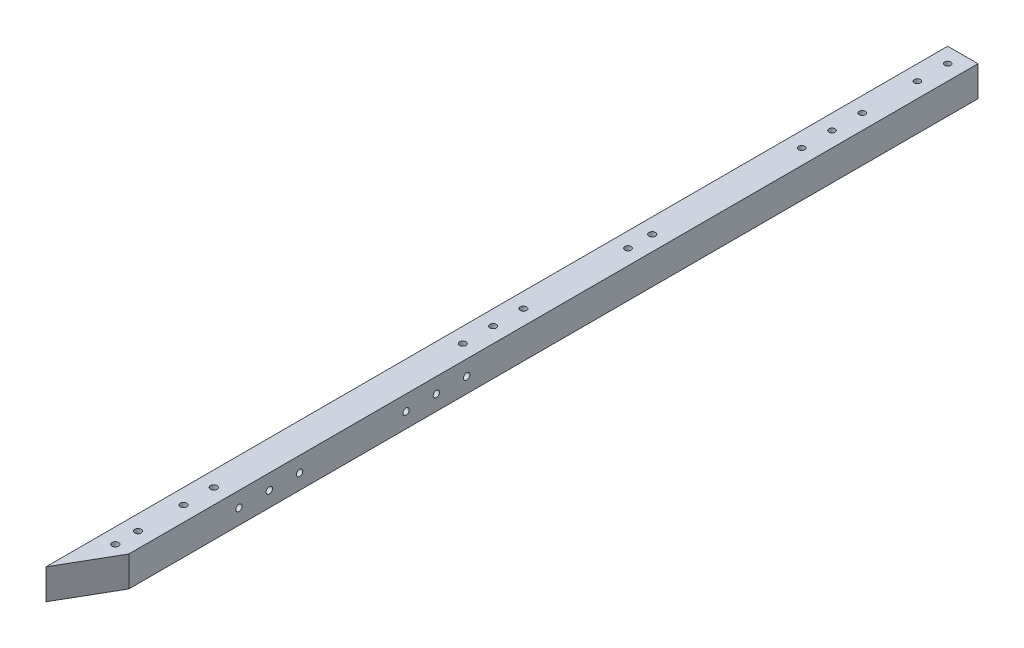
from build123d import *

# Parameters (mm, degrees)
SKETCH_1_W               = 20
SKETCH_1_H               = 20
EXTRUDE_1_DEPTH          = 595.07
CUT_EXTRUDE_1_DEPTH      = 595.07
CUT_EXTRUDE_2_DEPTH      = 596.741810603
CUT_EXTRUDE_2_DEPTH_BACK = 596.741810603
SKETCH_3_R               = 2
SKETCH_4_R               = 2.15
CUT_EXTRUDE_3_DEPTH      = 20
SKETCH_5_R               = 2.15
SKETCH_5_R_2             = 2.1
CUT_EXTRUDE_4_DEPTH      = 137
SKETCH_9_R               = 2.1
CUT_EXTRUDE_5_DEPTH      = 32


with BuildPart() as part:
    # 草图1 → 凸台-拉伸1 (new body)
    with BuildSketch(Plane.XY):
        with Locations((10, 10)):
            Rectangle(SKETCH_1_W, SKETCH_1_H)
    extrude(amount=EXTRUDE_1_DEPTH)

    # 草图2 → 切除-拉伸1 (cut)
    with BuildSketch(Plane(origin=(0, 20, 0), x_dir=(1, 0, 0), z_dir=(0, 1, 0))):
        Polygon((0, -595.07), (20, -560.428983849), (20, -595.07), align=None)
    extrude(amount=-CUT_EXTRUDE_1_DEPTH, mode=Mode.SUBTRACT)

    # 草图3 → 切除-拉伸2 (cut, two sides: drawn at the far end of the back side and taken through both)
    with BuildSketch(Plane(origin=(0, 20, 0), x_dir=(1, 0, 0), z_dir=(0, 1, 0)).offset(-CUT_EXTRUDE_2_DEPTH_BACK)):
        with Locations(Location((10, -10, 0), (0, 0, 270))):
            Circle(SKETCH_3_R)
        with Locations(Location((10, -30, 0), (0, 0, 270))):
            Circle(SKETCH_3_R)
        with Locations(Location((10, -66.35, 0), (0, 0, 270))):
            Circle(SKETCH_3_R)
        with Locations(Location((10, -86.35, 0), (0, 0, 270))):
            Circle(SKETCH_3_R)
        with Locations(Location((10, -106.35, 0), (0, 0, 270))):
            Circle(SKETCH_3_R)
    extrude(amount=CUT_EXTRUDE_2_DEPTH + CUT_EXTRUDE_2_DEPTH_BACK, mode=Mode.SUBTRACT)

    # 草图4 → 切除-拉伸3 (cut)
    with BuildSketch(Plane(origin=(0, 20, 0), x_dir=(1, 0, 0), z_dir=(0, 1, 0))):
        with Locations(Location((10, -544.338983849, 0), (0, 0, 270))):
            Circle(SKETCH_4_R)
        with Locations(Location((10, -559.338983849, 0), (0, 0, 270))):
            Circle(SKETCH_4_R)
        with Locations(Location((10, -514.338983849, 0), (0, 0, 270))):
            Circle(SKETCH_4_R)
        with Locations(Location((10, -494.338983849, 0), (0, 0, 270))):
            Circle(SKETCH_4_R)
    extrude(amount=-CUT_EXTRUDE_3_DEPTH, mode=Mode.SUBTRACT)

    # 草图5 → 切除-拉伸4 (cut)
    with BuildSketch(Plane(origin=(0, 20, 0), x_dir=(1, 0, 0), z_dir=(0, 1, 0))):
        with Locations(Location((10, -205, 0), (0, 0, 270))):
            Circle(SKETCH_5_R)
        with Locations(Location((10, -221, 0), (0, 0, 270))):
            Circle(SKETCH_5_R_2)
        with Locations(Location((10, -310, 0), (0, 0, 270))):
            Circle(SKETCH_5_R_2)
        with Locations(Location((10, -290, 0), (0, 0, 270))):
            Circle(SKETCH_5_R_2)
        with Locations(Location((10, -330, 0), (0, 0, 270))):
            Circle(SKETCH_5_R_2)
    extrude(amount=-CUT_EXTRUDE_4_DEPTH, mode=Mode.SUBTRACT)

    # 草图9 → 切除-拉伸5 (cut)
    with BuildSketch(Plane(origin=(20, 0, 0), x_dir=(0, 0, -1), z_dir=(1, 0, 0))):
        with Locations((-467.690453805, 10)):
            Circle(SKETCH_9_R)
        with Locations((-487.690453805, 10)):
            Circle(SKETCH_9_R)
        with Locations((-447.690453805, 10)):
            Circle(SKETCH_9_R)
        with Locations((-357.460423925, 10)):
            Circle(SKETCH_9_R)
        with Locations((-377.460423925, 10)):
            Circle(SKETCH_9_R)
        with Locations((-337.460423925, 10)):
            Circle(SKETCH_9_R)
    extrude(amount=-CUT_EXTRUDE_5_DEPTH, mode=Mode.SUBTRACT)


solid = part.part
